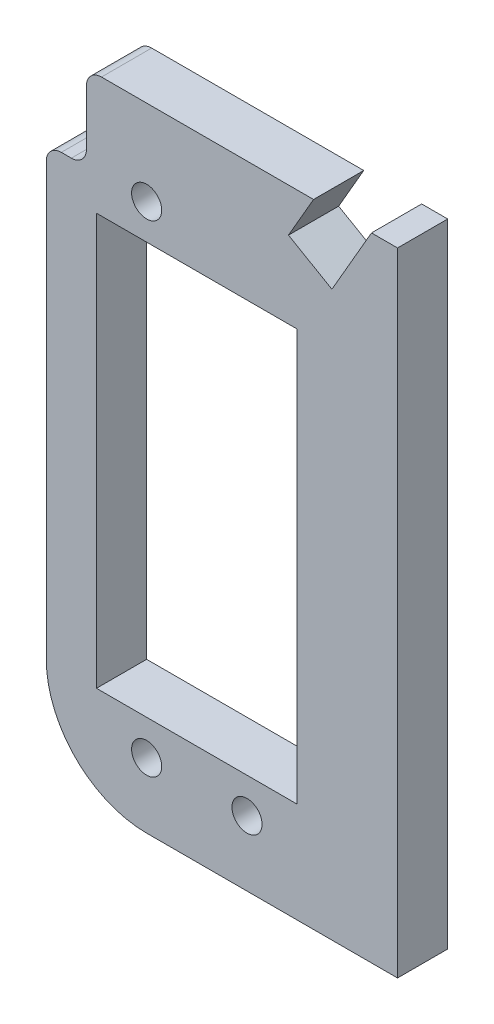
from build123d import *

# Parameters (mm, degrees)
ESQUISSE1_R        = 1.5
BOSS_EXTRU_1_DEPTH = 5
CONG_2_R           = 10
CONG_4_R           = 1.5


with BuildPart() as part:
    # Esquisse1 → Boss.-Extru.1 (new body)
    with BuildSketch(Plane.XY):
        Polygon((0, 0), (25, 0), (35, 0), (35, 63), (32.405486101, 63), (28.462110428, 56.169872981), (24.131983409, 58.669872981), (26.631983409, 63), (4, 63), (4, 54.5), (0, 54.5), align=None)
        with Locations((10, 54.5)):
            Circle(ESQUISSE1_R, mode=Mode.SUBTRACT)
        with Locations((20, 6.5)):
            Circle(ESQUISSE1_R, mode=Mode.SUBTRACT)
        with Locations((10, 6.5)):
            Circle(ESQUISSE1_R, mode=Mode.SUBTRACT)
        Polygon((15, 51), (5, 51), (5, 10), (25, 10), (25, 51), align=None, mode=Mode.SUBTRACT)
    extrude(amount=BOSS_EXTRU_1_DEPTH)

    # Congé2
    cong_2_edges = [part.edges().sort_by_distance(p)[0] for p in [
        (0, 0, 2.5),
    ]]
    fillet(cong_2_edges, radius=CONG_2_R)

    # Congé4
    cong_4_edges = [part.edges().sort_by_distance(p)[0] for p in [
        (0, 54.5, 2.5),
        (4, 54.5, 2.5),
        (4, 63, 2.5),
    ]]
    fillet(cong_4_edges, radius=CONG_4_R)


solid = part.part
